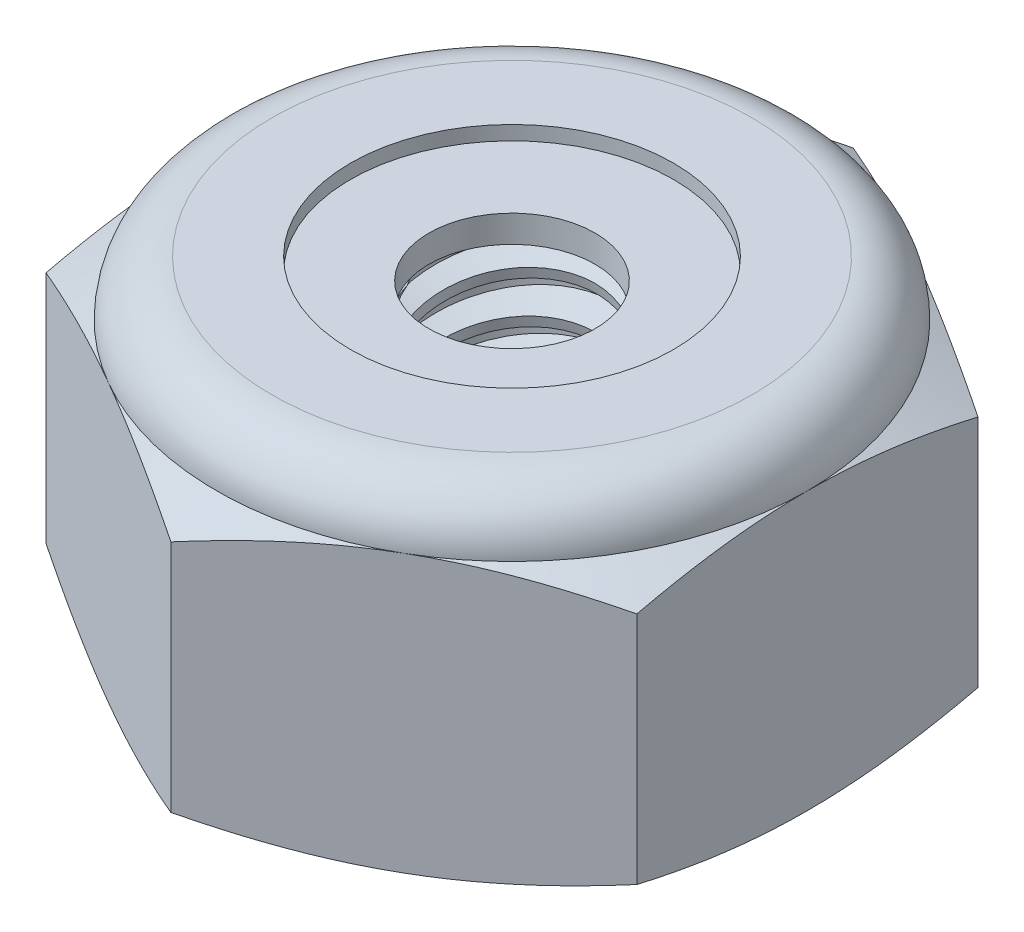
from build123d import *

# Parameters (mm, degrees)
EXTRUDE1_DEPTH      = 3.571875
SKETCH2_W           = 1.0922
SKETCH2_H           = 3.571875
LPATTERN1_COUNT     = 8
LPATTERN1_PITCH     = 0.453571429
LPATTERN1_COL_COUNT = 2
LPATTERN1_COL_PITCH = 0.453571429


with BuildPart() as part:
    # Sketch1 → Extrude1 (new body)
    with BuildSketch(Plane(origin=(0, 0, 0), x_dir=(1, 0, 0), z_dir=(0, 1, 0))):
        Polygon((0, 3.666174209), (-3.175, 1.833087105), (-3.175, -1.833087105), (0, -3.666174209), (3.175, -1.833087105), (3.175, 1.833087105), align=None)
    extrude(amount=EXTRUDE1_DEPTH)

    # Sketch4 → Cut-Revolve2 (revolve, cut)
    with BuildSketch(Plane(origin=(0, 0, 0), x_dir=(0, 0, -1), z_dir=(1, 0, 0)), mode=Mode.PRIVATE) as cut_revolve2_sk:
        Polygon((0, 3.571875), (1.0922, 3.571875), (0.892167741, 3.478598426), (0.892167741, 0.093276574), (1.0922, 0), (0, 0), align=None)
    revolve(cut_revolve2_sk.sketch.rotate(Axis((0, 3.571875, 0), (0, 1, 0)), 47.516980114), axis=Axis((0, 3.571875, 0), (0, 1, 0)), mode=Mode.SUBTRACT)


with BuildPart() as body_2:
    # Sketch2 → Revolve1 (revolve)
    with BuildSketch(Plane(origin=(0, 0, 0), x_dir=(0, 0, -1), z_dir=(1, 0, 0))):
        with Locations((0.5461, 1.7859375)):
            Rectangle(SKETCH2_W, SKETCH2_H)
    revolve(axis=Axis((0, -1.0922, 0), (0, 1, 0)))

    # Sketch3 → Cut-Revolve1 (revolve, cut)
    with BuildSketch(Plane(origin=(0, 0, 0), x_dir=(0, 0, -1), z_dir=(1, 0, 0)), mode=Mode.PRIVATE) as cut_revolve1_sk:
        Polygon((1.103726651, 3.516362647), (1.184413211, 3.127776177), (0.915221043, 3.216645195), (0.892167741, 3.327669901), align=None)
    cut_revolve1 = revolve(cut_revolve1_sk.sketch.rotate(Axis((0, 3.571875, 0.101196353), (0, -0.9791155152480937, -0.20330471662128255)), 180), axis=Axis((0, 3.571875, 0.101196353), (0, -0.9791155152480937, -0.20330471662128255)), mode=Mode.SUBTRACT)

    # LPattern1: Cut-Revolve1 ×8
    with Locations(*[(0, -i * LPATTERN1_PITCH, 0) for i in range(1, LPATTERN1_COUNT)]):
        add(cut_revolve1, mode=Mode.SUBTRACT)

    # LPattern1 col: Cut-Revolve1 ×2
    with Locations(*[(0, i * LPATTERN1_COL_PITCH, 0) for i in range(1, LPATTERN1_COL_COUNT)]):
        add(cut_revolve1, mode=Mode.SUBTRACT)


with BuildPart() as part_1:
    add(part.part)

    # Combine1: cut body 2
    add(body_2.part, mode=Mode.SUBTRACT)

    # Sketch5 → Cut-Revolve3 (revolve, cut)
    with BuildSketch(Plane(origin=(0, 0, 0), x_dir=(0, 0, -1), z_dir=(1, 0, 0)), mode=Mode.PRIVATE) as cut_revolve3_sk:
        with BuildLine():
            Line((0, 0), (3.175, 0))
            Line((3.175, 0), (3.666174209, 0.229038295))
            Line((3.666174209, 0.229038295), (3.666174209, 2.747524205))
            Line((3.666174209, 2.747524205), (3.175, 2.9765625))
            ThreePointArc((3.175, 2.9765625), (3.000637006, 3.397512006), (2.5796875, 3.571875))
            Line((2.5796875, 3.571875), (2.5796875, 4.841875))
            Line((2.5796875, 4.841875), (4.936174209, 4.841875))
            Line((4.936174209, 4.841875), (4.936174209, -1.27))
            Line((4.936174209, -1.27), (0, -1.27))
            Line((0, -1.27), (0, 0))
        make_face()
    revolve(cut_revolve3_sk.sketch.rotate(Axis((0, 0, 0), (0, 1, 0)), 47.516980114), axis=Axis((0, 0, 0), (0, 1, 0)), mode=Mode.SUBTRACT)

    # Sketch6 → Cut-Revolve4 (revolve, cut)
    with BuildSketch(Plane(origin=(0, 0, 0), x_dir=(0, 0, -1), z_dir=(1, 0, 0)), mode=Mode.PRIVATE) as cut_revolve4_sk:
        with BuildLine():
            Line((0, 2.9765625), (3.0226, 2.9765625))
            ThreePointArc((3.0226, 2.9765625), (2.892873932, 3.289748932), (2.5796875, 3.419475))
            Line((2.5796875, 3.419475), (1.73592762, 3.419475))
            Line((1.73592762, 3.419475), (1.73592762, 4.841875))
            Line((1.73592762, 4.841875), (0, 4.841875))
            Line((0, 4.841875), (0, 2.9765625))
        make_face()
    revolve(cut_revolve4_sk.sketch.rotate(Axis((0, 4.841875, 0), (0, 1, 0)), 47.516980114), axis=Axis((0, 4.841875, 0), (0, 1, 0)), mode=Mode.SUBTRACT)


with BuildPart() as body_2_2:
    # Sketch7 → Revolve2 (revolve)
    with BuildSketch(Plane(origin=(0, 0, 0), x_dir=(0, 0, -1), z_dir=(1, 0, 0))):
        with BuildLine():
            Line((0.892167741, 3.0527625), (2.938395763, 3.0527625))
            ThreePointArc((2.938395763, 3.0527625), (2.810484559, 3.261537543), (2.5796875, 3.343275))
            Line((2.5796875, 3.343275), (0.892167741, 3.343275))
            Line((0.892167741, 3.343275), (0.892167741, 3.0527625))
        make_face()
    revolve(axis=Axis((0, 3.0527625, 0), (0, 1, 0)))


solid = Compound([part_1.part, body_2_2.part])
